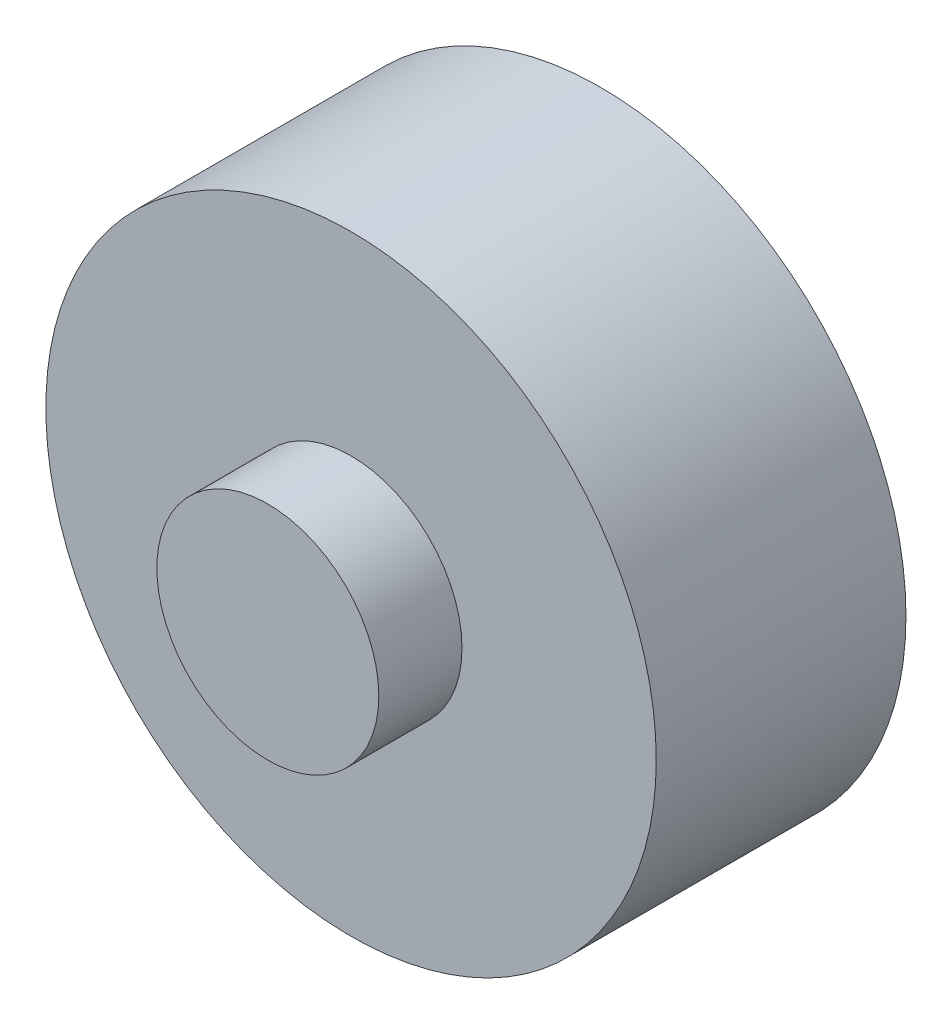
from build123d import *

# Parameters (mm, degrees)
SKETCH_1_R      = 8
EXTRUDE_1_DEPTH = 24
SKETCH_2_R      = 22
EXTRUDE_2_DEPTH = 18


with BuildPart() as part:
    # 草图1 → 凸台-拉伸1 (new body)
    with BuildSketch(Plane.XY):
        Circle(SKETCH_1_R)
    extrude(amount=EXTRUDE_1_DEPTH)

    # 草图2 → 凸台-拉伸2 (add)
    with BuildSketch(Plane.XY):
        Circle(SKETCH_2_R)
    extrude(amount=EXTRUDE_2_DEPTH)


solid = part.part
